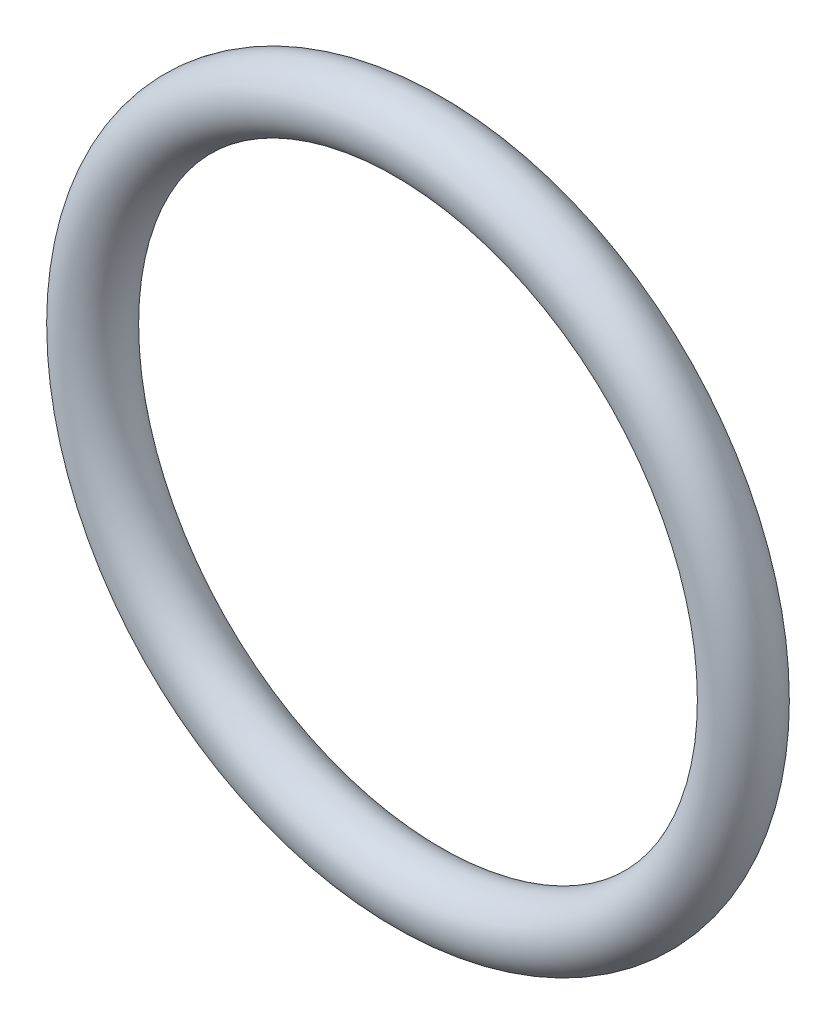
from build123d import *

# Parameters (mm, degrees)
SKETCH2_R = 0.5


with BuildPart() as part:
    # Sketch2 → Revolve1 (revolve)
    with BuildSketch(Plane(origin=(0, 0, 0), x_dir=(1, 0, 0), z_dir=(0, 1, 0)), mode=Mode.PRIVATE) as revolve1_sk:
        with Locations((5, 0)):
            Circle(SKETCH2_R)
    revolve(revolve1_sk.sketch.rotate(Axis((0, 0, -0.5), (0, 0, 1)), 180), axis=Axis((0, 0, -0.5), (0, 0, 1)))


solid = part.part
